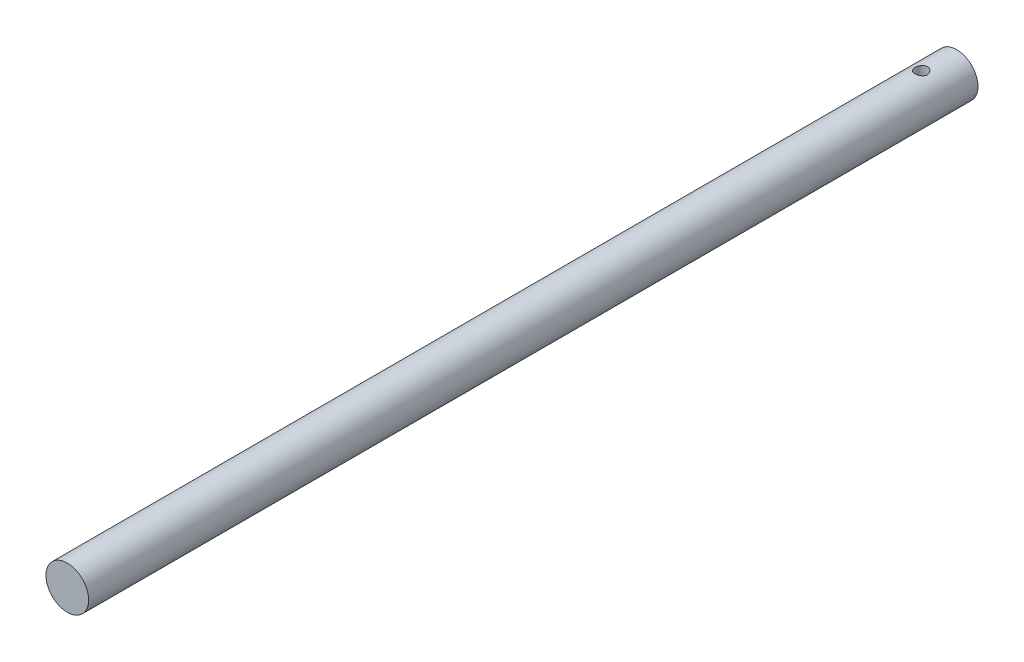
from build123d import *

# Parameters (mm, degrees)
SKETCH1_R           = 6
BOSS_EXTRUDE1_DEPTH = 250
SKETCH2_R           = 1.75
CUT_EXTRUDE1_DEPTH  = 18


with BuildPart() as part:
    # Sketch1 → Boss-Extrude1 (new body)
    with BuildSketch(Plane.XY):
        Circle(SKETCH1_R)
    extrude(amount=BOSS_EXTRUDE1_DEPTH)

    # Sketch2 → Cut-Extrude1 (cut, symmetric)
    with BuildSketch(Plane(origin=(0, 0, 0), x_dir=(1, 0, 0), z_dir=(0, 1, 0))):
        with Locations(Location((0, -10, 0), (0, 0, 270))):
            Circle(SKETCH2_R)
    extrude(amount=CUT_EXTRUDE1_DEPTH, both=True, mode=Mode.SUBTRACT)


solid = part.part
